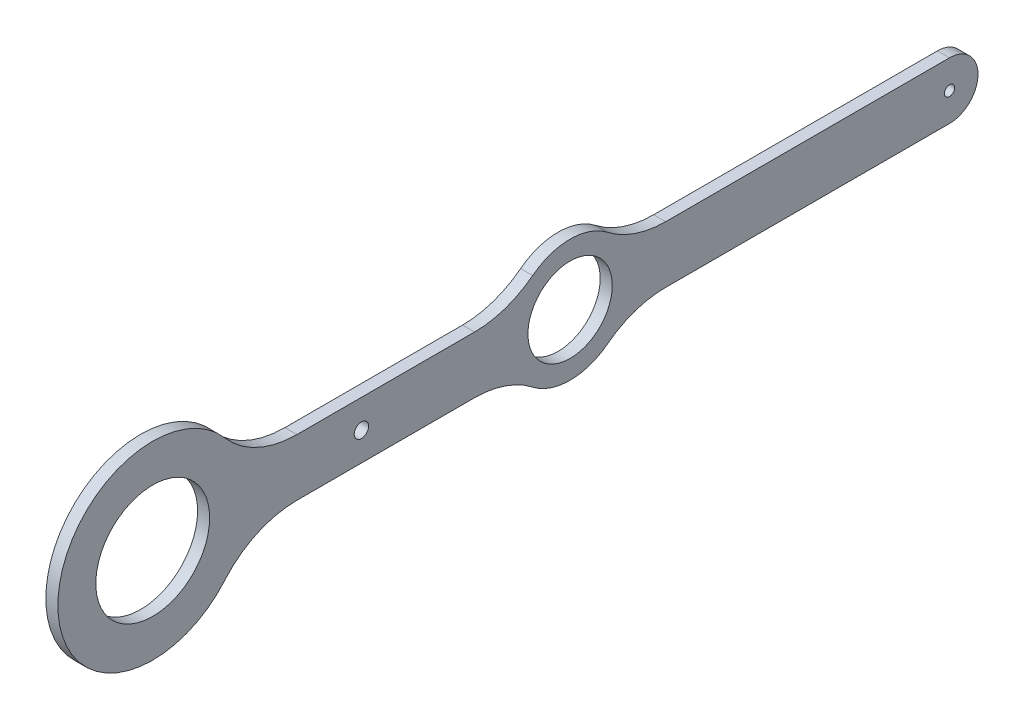
from build123d import *

# Parameters (mm, degrees)
SKETCH1_R             = 15
SKETCH1_R_2           = 11.1125
BOSS_EXTRUDE1_DEPTH   = 3.175
F_6_CLEARANCE_HOLE1_D = 3.7973
F_6_32_TAPPED_HOLE1_D = 2.7051
FILLET1_R             = 25


with BuildPart() as part:
    # Sketch1 → Boss-Extrude1 (new body)
    with BuildSketch(Plane(origin=(0, 0, 0), x_dir=(0, 0, -1), z_dir=(1, 0, 0))):
        with BuildLine():
            ThreePointArc((-86.151519965, 7.5), (-135, 0), (-86.151519965, -7.5))
            Line((-86.151519965, -7.5), (-14.260527909, -7.5))
            ThreePointArc((-14.260527909, -7.5), (0, -16.1125), (14.260527909, -7.5))
            Line((14.260527909, -7.5), (100, -7.5))
            ThreePointArc((100, -7.5), (107.5, 0), (100, 7.5))
            Line((100, 7.5), (14.260527909, 7.5))
            ThreePointArc((14.260527909, 7.5), (0, 16.1125), (-14.260527909, 7.5))
            Line((-14.260527909, 7.5), (-86.151519965, 7.5))
        make_face()
        with Locations((-110, 0)):
            Circle(SKETCH1_R, mode=Mode.SUBTRACT)
        Circle(SKETCH1_R_2, mode=Mode.SUBTRACT)
    extrude(amount=BOSS_EXTRUDE1_DEPTH)

    # #6 Clearance Hole1 (through all)
    with Locations(Plane(origin=(3.175, 0, 0), x_dir=(0, 0, -1), z_dir=(1, 0, 0))):
        with Locations((-55, 0)):
            Hole(F_6_CLEARANCE_HOLE1_D / 2)

    # #6-32 Tapped Hole1 (through all)
    with Locations(Plane(origin=(3.175, 0, 0), x_dir=(0, 0, -1), z_dir=(1, 0, 0))):
        with Locations((100, 0)):
            Hole(F_6_32_TAPPED_HOLE1_D / 2)

    # Fillet1
    fillet1_edges = [part.edges().sort_by_distance(p)[0] for p in [
        (1.5875, 7.5, 86.151519965),
        (1.5875, 7.5, 14.260527909),
        (1.5875, 7.5, -14.260527909),
        (1.5875, -7.5, -14.260527909),
        (1.5875, -7.5, 14.260527909),
        (1.5875, -7.5, 86.151519965),
    ]]
    fillet(fillet1_edges, radius=FILLET1_R)


solid = part.part
